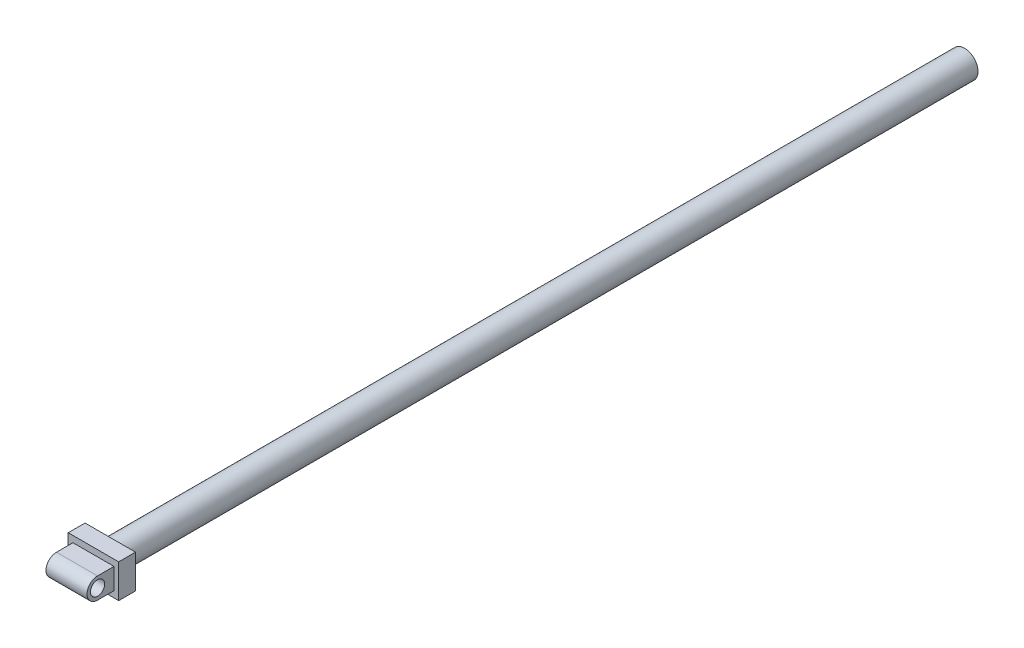
from build123d import *

# Parameters (mm, degrees)
SKETCH1_W           = 12.2
SKETCH1_H           = 10
BOSS_EXTRUDE1_DEPTH = 10
SKETCH2_R           = 2.125
CUT_EXTRUDE1_DEPTH  = 12.2
SKETCH3_W           = 15
SKETCH3_H           = 10
BOSS_EXTRUDE2_DEPTH = 5
SKETCH4_R           = 4
BOSS_EXTRUDE3_DEPTH = 254


with BuildPart() as part:
    # Sketch1 → Boss-Extrude1 (new body)
    with BuildSketch(Plane.XY):
        Rectangle(SKETCH1_W, SKETCH1_H)
    extrude(amount=BOSS_EXTRUDE1_DEPTH)

    # Sketch2 → Cut-Extrude1 (cut)
    with BuildSketch(Plane.ZY.offset(6.1)):
        with Locations((4.889205296, 0)):
            Circle(SKETCH2_R)
        with BuildLine():
            Line((4.889205296, 3.125), (0, 3.125))
            Line((0, 3.125), (0, 5))
            Line((0, 5), (10, 5))
            Line((10, 5), (10, -5))
            Line((10, -5), (0, -5))
            Line((0, -5), (0, -3.125))
            Line((0, -3.125), (4.889205296, -3.125))
            ThreePointArc((4.889205296, -3.125), (8.014205296, 0), (4.889205296, 3.125))
        make_face()
    extrude(amount=-CUT_EXTRUDE1_DEPTH, mode=Mode.SUBTRACT)

    # Sketch3 → Boss-Extrude2 (add)
    with BuildSketch(Plane(origin=(0, 0, 0), x_dir=(-1, 0, 0), z_dir=(0, 0, -1))):
        Rectangle(SKETCH3_W, SKETCH3_H)
    extrude(amount=BOSS_EXTRUDE2_DEPTH)

    # Sketch4 → Boss-Extrude3 (add)
    with BuildSketch(Plane(origin=(0, 0, -5), x_dir=(-1, 0, 0), z_dir=(0, 0, -1))):
        Circle(SKETCH4_R)
    extrude(amount=BOSS_EXTRUDE3_DEPTH)


solid = part.part
